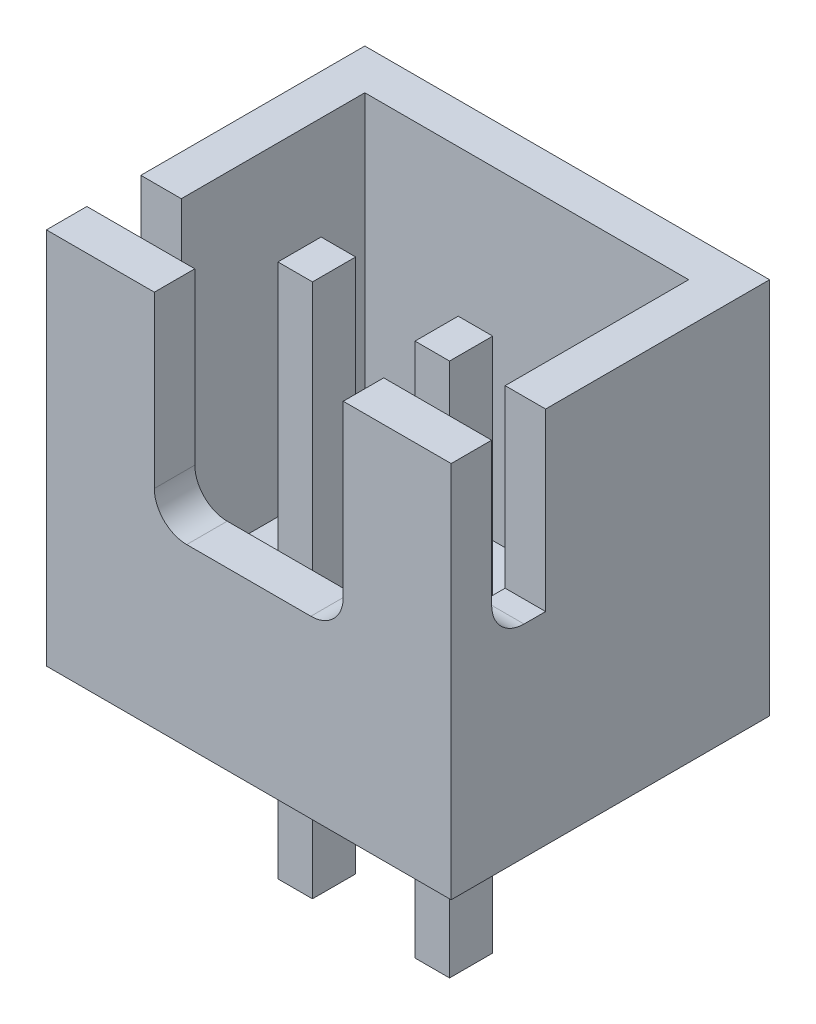
from build123d import *

# Parameters (mm, degrees)
CROQUIS1_W                   = 7.5
CROQUIS1_H                   = 5.9
CROQUIS1_W_2                 = 0.64
CROQUIS1_H_2                 = 0.8
SALIENTE_EXTRUIR1_DEPTH      = 1
CROQUIS2_W                   = 7.5
CROQUIS2_H                   = 5.9
CROQUIS2_W_2                 = 6
CROQUIS2_H_2                 = 4.4
SALIENTE_EXTRUIR2_DEPTH      = 6
CORTAR_EXTRUIR1_DEPTH        = 9
CORTAR_EXTRUIR2_DEPTH        = 2
SALIENTE_EXTRUIR3_DEPTH      = 6.5
SALIENTE_EXTRUIR3_DEPTH_BACK = 3.4
CROQUIS5_W                   = 0.64
CROQUIS5_H                   = 0.8


with BuildPart() as part:
    # Croquis1 → Saliente-Extruir1 (new body)
    with BuildSketch(Plane(origin=(0, 0, 0), x_dir=(1, 0, 0), z_dir=(0, 1, 0))):
        with Locations((1.27, 0.42)):
            Rectangle(CROQUIS1_W, CROQUIS1_H)
        Rectangle(CROQUIS1_W_2, CROQUIS1_H_2, mode=Mode.SUBTRACT)
        with Locations((2.54, 0)):
            Rectangle(CROQUIS1_W_2, CROQUIS1_H_2, mode=Mode.SUBTRACT)
    extrude(amount=SALIENTE_EXTRUIR1_DEPTH)

    # Croquis2 → Saliente-Extruir2 (add)
    with BuildSketch(Plane(origin=(0, 1, 0), x_dir=(1, 0, 0), z_dir=(0, 1, 0))):
        with Locations((1.27, 0.42)):
            Rectangle(CROQUIS2_W, CROQUIS2_H)
        with Locations((1.27, 0.42)):
            Rectangle(CROQUIS2_W_2, CROQUIS2_H_2, mode=Mode.SUBTRACT)
    extrude(amount=SALIENTE_EXTRUIR2_DEPTH)

    # Croquis3 → Cortar-Extruir1 (cut)
    with BuildSketch(Plane.ZY.offset(2.48)):
        with BuildLine():
            Line((1.78, 7), (1.78, 4.35))
            ThreePointArc((1.78, 4.35), (1.604264069, 3.925735931), (1.18, 3.75))
            Line((1.18, 3.75), (0.78, 3.75))
            Line((0.78, 3.75), (0.78, 7))
            Line((0.78, 7), (1.78, 7))
        make_face()
    extrude(amount=-CORTAR_EXTRUIR1_DEPTH, mode=Mode.SUBTRACT)

    # Croquis4 → Cortar-Extruir2 (cut)
    with BuildSketch(Plane.XY.offset(2.53)):
        with BuildLine():
            Line((-0.48, 3.85), (-0.48, 7))
            Line((-0.48, 7), (3.02, 7))
            Line((3.02, 7), (3.02, 3.85))
            ThreePointArc((3.02, 3.85), (2.844264069, 3.425735931), (2.42, 3.25))
            Line((2.42, 3.25), (1.266494324, 3.25))
            Line((1.266494324, 3.25), (0.12, 3.25))
            ThreePointArc((0.12, 3.25), (-0.304264069, 3.425735931), (-0.48, 3.85))
        make_face()
    extrude(amount=-CORTAR_EXTRUIR2_DEPTH, mode=Mode.SUBTRACT)

    # Croquis5 → Saliente-Extruir3 (add, two sides: drawn at the far end of the back side and taken through both)
    with BuildSketch(Plane(origin=(0, 0, 0), x_dir=(1, 0, 0), z_dir=(0, 1, 0)).offset(-SALIENTE_EXTRUIR3_DEPTH_BACK)):
        with Locations((2.54, 0)):
            Rectangle(CROQUIS5_W, CROQUIS5_H)
        Rectangle(CROQUIS5_W, CROQUIS5_H)
    extrude(amount=SALIENTE_EXTRUIR3_DEPTH + SALIENTE_EXTRUIR3_DEPTH_BACK)


solid = part.part
